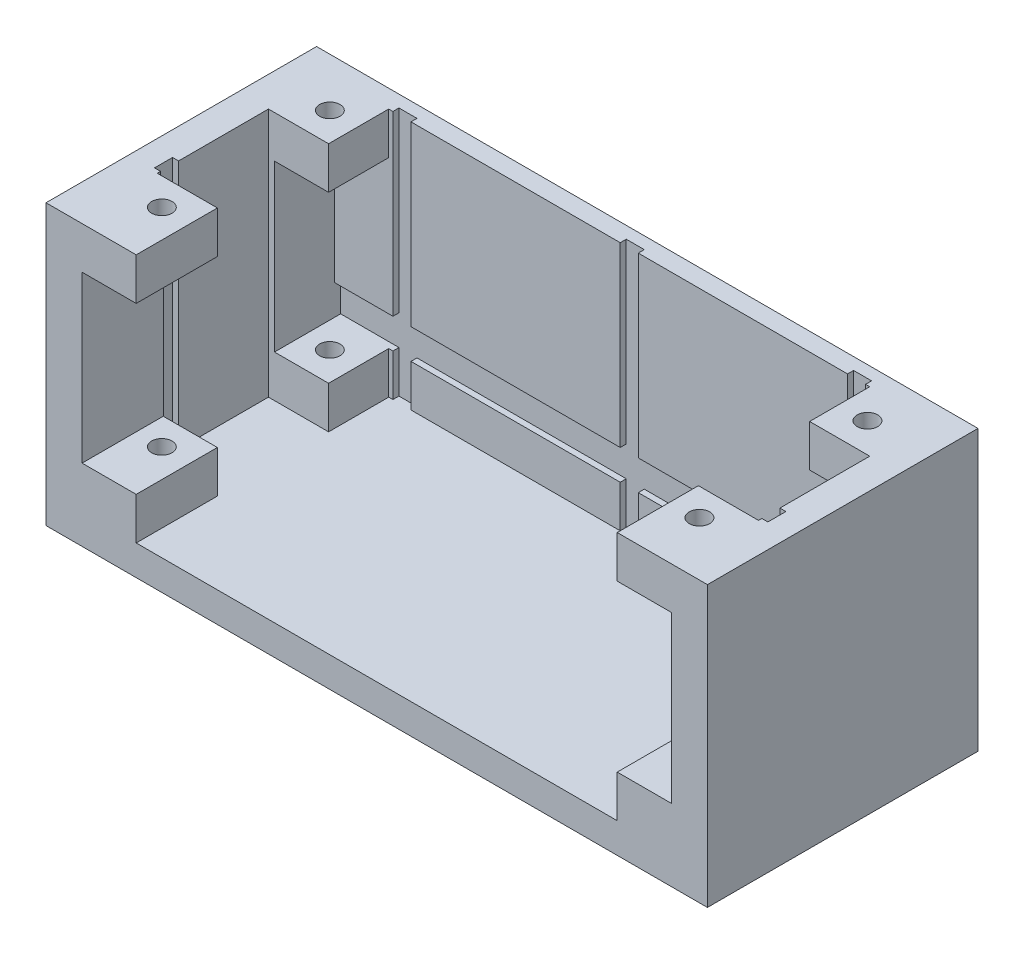
from build123d import *

# Parameters (mm, degrees)
SKETCH1_W            = 110
SKETCH1_H            = 45
BOSS_EXTRUDE1_DEPTH  = 46.5
SKETCH2_W            = 100
SKETCH2_H            = 42
CUT_EXTRUDE1_DEPTH   = 41.5
SKETCH24_W           = 3
SKETCH24_H           = 1
CUT_EXTRUDE10_DEPTH  = 41.5
SKETCH26_W           = 10
SKETCH26_H           = 10
SKETCH26_H_2         = 13.5
BOSS_EXTRUDE2_DEPTH  = 41.5
M3_CLEARANCE_HOLE5_D = 3.4
SKETCH29_W           = 10
SKETCH29_H           = 27.5
SKETCH29_W_2         = 13.5
CUT_EXTRUDE11_DEPTH  = 9
SKETCH30_W           = 10
SKETCH30_H           = 27.5
SKETCH30_W_2         = 13.5
CUT_EXTRUDE12_DEPTH  = 9
SKETCH32_W           = 3
SKETCH32_H           = 1
CUT_EXTRUDE14_DEPTH  = 41.5
SKETCH33_W           = 1
SKETCH33_H           = 3
CUT_EXTRUDE15_DEPTH  = 41.5
SKETCH34_W           = 98
SKETCH34_H           = 5
CUT_EXTRUDE16_DEPTH  = 1


with BuildPart() as part:
    # Sketch1 → Boss-Extrude1 (new body)
    with BuildSketch(Plane(origin=(0, 0, 0), x_dir=(1, 0, 0), z_dir=(0, 1, 0))):
        with Locations((55, 22.5)):
            Rectangle(SKETCH1_W, SKETCH1_H)
    extrude(amount=BOSS_EXTRUDE1_DEPTH)

    # Sketch2 → Cut-Extrude1 (cut)
    with BuildSketch(Plane(origin=(0, 46.5, 0), x_dir=(1, 0, 0), z_dir=(0, 1, 0))):
        with Locations((55, 21)):
            Rectangle(SKETCH2_W, SKETCH2_H)
    extrude(amount=-CUT_EXTRUDE1_DEPTH, mode=Mode.SUBTRACT)

    # Sketch24 → Cut-Extrude10 (cut)
    with BuildSketch(Plane(origin=(0, 46.5, 0), x_dir=(1, 0, 0), z_dir=(0, 1, 0))):
        with Locations((55, 42.5)):
            Rectangle(SKETCH24_W, SKETCH24_H)
    extrude(amount=-CUT_EXTRUDE10_DEPTH, mode=Mode.SUBTRACT)

    # Sketch26 → Boss-Extrude2 (add)
    with BuildSketch(Plane(origin=(0, 5, 0), x_dir=(1, 0, 0), z_dir=(0, 1, 0))):
        with Locations((10, 37)):
            Rectangle(SKETCH26_W, SKETCH26_H)
        with Locations((10, 6.75)):
            Rectangle(SKETCH26_W, SKETCH26_H_2)
        with Locations((100, 37)):
            Rectangle(SKETCH26_W, SKETCH26_H)
        with Locations((100, 6.75)):
            Rectangle(SKETCH26_W, SKETCH26_H_2)
    extrude(amount=BOSS_EXTRUDE2_DEPTH)

    # M3 Clearance Hole5 (through all)
    with Locations(Plane(origin=(0, 46.5, 0), x_dir=(1, 0, 0), z_dir=(0, 1, 0))):
        with Locations((10.295, 36.91), (99.705, 36.91), (99.705, 8.97), (10.295, 8.97)):
            Hole(M3_CLEARANCE_HOLE5_D / 2)

    # Sketch29 → Cut-Extrude11 (cut)
    with BuildSketch(Plane(origin=(15, 0, 0), x_dir=(0, 0, -1), z_dir=(1, 0, 0))):
        with Locations((37, 25.75)):
            Rectangle(SKETCH29_W, SKETCH29_H)
        with Locations((6.75, 25.75)):
            Rectangle(SKETCH29_W_2, SKETCH29_H)
    extrude(amount=-CUT_EXTRUDE11_DEPTH, mode=Mode.SUBTRACT)

    # Sketch30 → Cut-Extrude12 (cut)
    with BuildSketch(Plane.ZY.offset(-95)):
        with Locations((-37, 25.75)):
            Rectangle(SKETCH30_W, SKETCH30_H)
        with Locations((-6.75, 25.75)):
            Rectangle(SKETCH30_W_2, SKETCH30_H)
    extrude(amount=-CUT_EXTRUDE12_DEPTH, mode=Mode.SUBTRACT)

    # Sketch32 → Cut-Extrude14 (cut)
    with BuildSketch(Plane(origin=(0, 46.5, 0), x_dir=(1, 0, 0), z_dir=(0, 1, 0))):
        with Locations((17.198, 42.5)):
            Rectangle(SKETCH32_W, SKETCH32_H)
        with Locations((92.802, 42.5)):
            Rectangle(SKETCH32_W, SKETCH32_H)
    extrude(amount=-CUT_EXTRUDE14_DEPTH, mode=Mode.SUBTRACT)

    # Sketch33 → Cut-Extrude15 (cut)
    with BuildSketch(Plane(origin=(0, 46.5, 0), x_dir=(1, 0, 0), z_dir=(0, 1, 0))):
        with Locations((4.5, 15.55)):
            Rectangle(SKETCH33_W, SKETCH33_H)
        with Locations((105.5, 15.55)):
            Rectangle(SKETCH33_W, SKETCH33_H)
    extrude(amount=-CUT_EXTRUDE15_DEPTH, mode=Mode.SUBTRACT)

    # Sketch34 → Cut-Extrude16 (cut)
    with BuildSketch(Plane.XY.offset(-42)):
        with Locations((55, 14.5)):
            Rectangle(SKETCH34_W, SKETCH34_H)
    extrude(amount=-CUT_EXTRUDE16_DEPTH, mode=Mode.SUBTRACT)


solid = part.part
